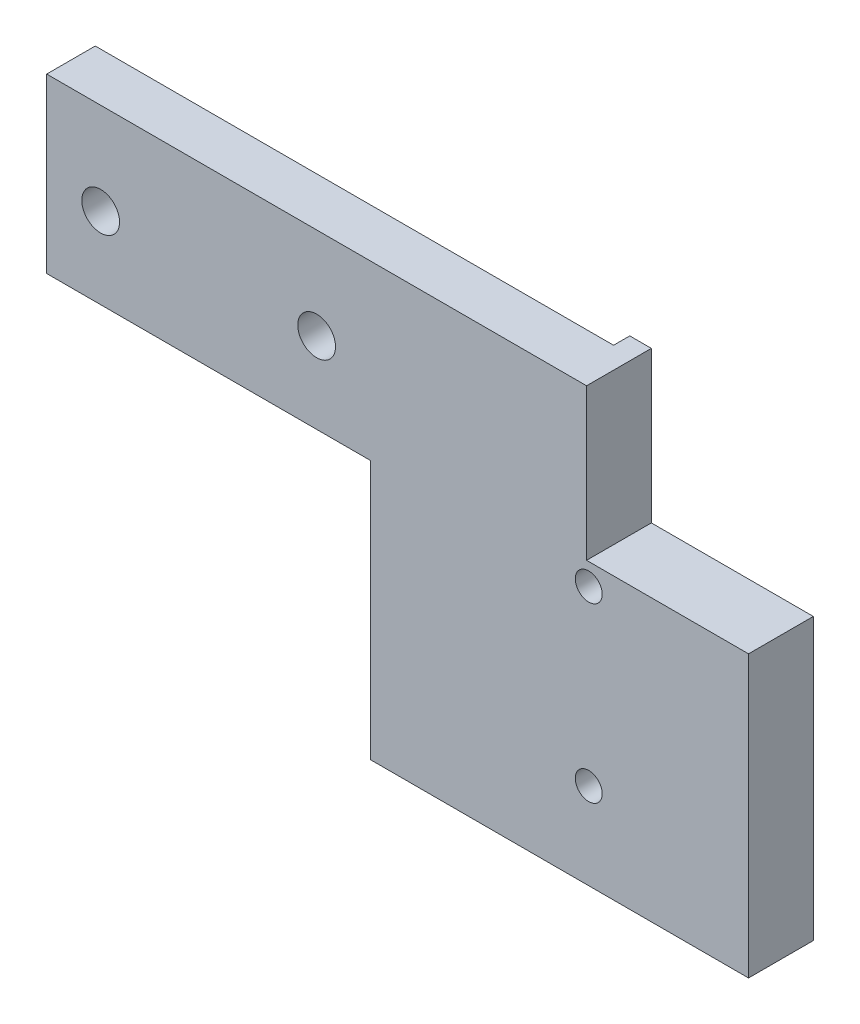
from build123d import *

# Parameters (mm, degrees)
SKETCH_1_W                  = 65
SKETCH_1_H                  = 40
EXTRUDE_1_DEPTH             = 6
SKETCH_2_W                  = 48
SKETCH_2_H                  = 1.5
CUT_EXTRUDE_1_DEPTH         = 77.557168182
HOLE_WIZARD_3_5_3_5_1_D     = 3.5
HOLE_WIZARD_3_5_3_5_1_DEPTH = 10
HOLE_WIZARD_3_5_3_5_1_TIP   = 1.051506083
HOLE_WIZARD_M3_1_D          = 2.5
SKETCH_7_W                  = 30
SKETCH_7_H                  = 24
CUT_EXTRUDE_2_DEPTH         = 10
SKETCH_9_W                  = 15
SKETCH_9_H                  = 14
CUT_EXTRUDE_3_DEPTH         = 77.557168182


with BuildPart() as part:
    # 草图1 → 凸台-拉伸1 (new body)
    with BuildSketch(Plane.XY):
        with Locations((32.5, 20)):
            Rectangle(SKETCH_1_W, SKETCH_1_H)
    extrude(amount=EXTRUDE_1_DEPTH)

    # 草图2 → 切除-拉伸1 (cut, through all)
    with BuildSketch(Plane(origin=(0, 40, 0), x_dir=(1, 0, 0), z_dir=(0, 1, 0))):
        with Locations((24, -0.75)):
            Rectangle(SKETCH_2_W, SKETCH_2_H)
    extrude(amount=-CUT_EXTRUDE_1_DEPTH, mode=Mode.SUBTRACT)

    # Ø3.5 (3.5) 直径孔1
    with Locations(Plane.XY.offset(6)):
        with Locations((25, 31.5), (5, 31.5)):
            Hole(HOLE_WIZARD_3_5_3_5_1_D / 2, depth=HOLE_WIZARD_3_5_3_5_1_DEPTH)
            with Locations((0, 0, -(HOLE_WIZARD_3_5_3_5_1_DEPTH + HOLE_WIZARD_3_5_3_5_1_TIP / 2))):  # 118° drill point
                Cone(0, HOLE_WIZARD_3_5_3_5_1_D / 2, HOLE_WIZARD_3_5_3_5_1_TIP, mode=Mode.SUBTRACT)

    # M3 螺纹孔1 (through all)
    with Locations(Plane.XY.offset(6)):
        with Locations((50.2, 8), (50.2, 24)):
            Hole(HOLE_WIZARD_M3_1_D / 2)

    # 草图7 → 切除-拉伸2 (cut)
    with BuildSketch(Plane.XY.offset(6)):
        with Locations((15, 12)):
            Rectangle(SKETCH_7_W, SKETCH_7_H)
    extrude(amount=-CUT_EXTRUDE_2_DEPTH, mode=Mode.SUBTRACT)

    # 草图9 → 切除-拉伸3 (cut, through all)
    with BuildSketch(Plane.XY.offset(6)):
        with Locations((57.5, 33)):
            Rectangle(SKETCH_9_W, SKETCH_9_H)
    extrude(amount=-CUT_EXTRUDE_3_DEPTH, mode=Mode.SUBTRACT)


solid = part.part
